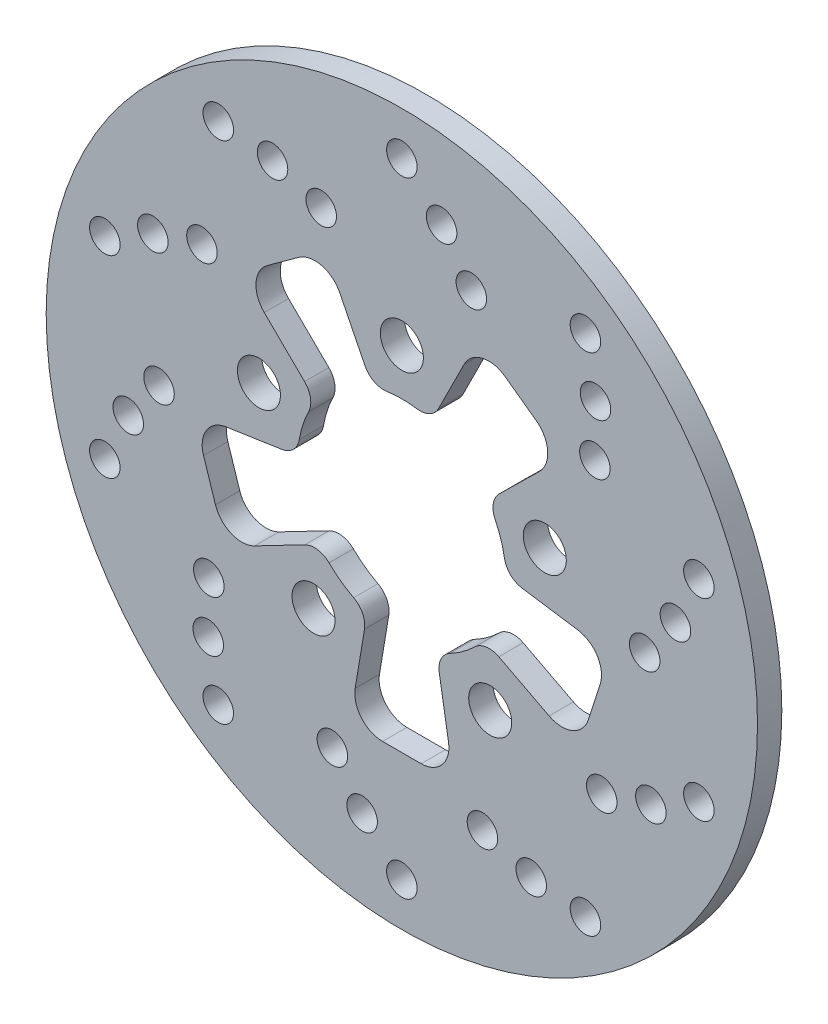
from build123d import *

# Parameters (mm, degrees)
SKETCH1_R                = 130.175
SKETCH1_R_2              = 7.874
EXTRUDE1_DEPTH           = 8.89
SKETCH3_R                = 38.1
EXTRUDE3_DEPTH           = 185.309775514
SKETCH4_R                = 5.588
EXTRUDE4_DEPTH           = 185.309775514
EXTRUDE9_DEPTH           = 185.309775514
FILLET1_R                = 7.62
FILLET2_R                = 10.16
CIRPATTERN1_COUNT        = 5
FILLET1_OF_CIRPATTERN1_R = 7.62
FILLET2_OF_CIRPATTERN1_R = 10.16


with BuildPart() as part:
    # Sketch1 → Extrude1 (new body)
    with BuildSketch(Plane.XY):
        Circle(SKETCH1_R)
        with Locations((0, 55)):
            Circle(SKETCH1_R_2, mode=Mode.SUBTRACT)
        with Locations((52.308108396, 16.995934691)):
            Circle(SKETCH1_R_2, mode=Mode.SUBTRACT)
        with Locations((32.328188876, -44.495934691)):
            Circle(SKETCH1_R_2, mode=Mode.SUBTRACT)
        with Locations((-32.328188876, -44.495934691)):
            Circle(SKETCH1_R_2, mode=Mode.SUBTRACT)
        with Locations((-52.308108396, 16.995934691)):
            Circle(SKETCH1_R_2, mode=Mode.SUBTRACT)
    extrude(amount=EXTRUDE1_DEPTH)

    # Sketch3 → Extrude3 (cut, through all)
    with BuildSketch(Plane(origin=(0, 0, 0), x_dir=(-1, 0, 0), z_dir=(0, 0, -1))):
        Circle(SKETCH3_R)
    extrude(amount=-EXTRUDE3_DEPTH, mode=Mode.SUBTRACT)

    # Sketch4 → Extrude4 (cut, through all)
    with BuildSketch(Plane.XY.offset(8.89)):
        with Locations((0, 114.3)):
            Circle(SKETCH4_R)
        with Locations((14.540907903, 100.554074991)):
            Circle(SKETCH4_R)
        with Locations((25.431391759, 85.18482443)):
            Circle(SKETCH4_R)
        with Locations((70.868043945, 72.803024301)):
            Circle(SKETCH4_R)
        with Locations((70.644811643, 53.967773605)):
            Circle(SKETCH4_R)
        with Locations((67.183854337, 92.470642457)):
            Circle(SKETCH4_R)
        with Locations((100.125995916, 17.243692812)):
            Circle(SKETCH4_R)
        with Locations((88.874314608, 2.13686756)):
            Circle(SKETCH4_R)
        with Locations((108.705759813, 35.320642457)):
            Circle(SKETCH4_R)
        with Locations((91.139220605, -44.90214324)):
            Circle(SKETCH4_R)
        with Locations((73.156850119, -50.510249263)):
            Circle(SKETCH4_R)
        with Locations((108.705759813, -35.320642457)):
            Circle(SKETCH4_R)
        with Locations((47.34036073, -89.896886742)):
            Circle(SKETCH4_R)
        with Locations((29.495955395, -83.864167648)):
            Circle(SKETCH4_R)
        with Locations((67.183854337, -92.470642457)):
            Circle(SKETCH4_R)
        with Locations((-14.540907903, -100.554074991)):
            Circle(SKETCH4_R)
        with Locations((-25.431391759, -85.18482443)):
            Circle(SKETCH4_R)
        with Locations((0, -114.3)):
            Circle(SKETCH4_R)
        with Locations((-70.868043945, -72.803024301)):
            Circle(SKETCH4_R)
        with Locations((-70.644811643, -53.967773605)):
            Circle(SKETCH4_R)
        with Locations((-67.183854337, -92.470642457)):
            Circle(SKETCH4_R)
        with Locations((-100.125995916, -17.243692812)):
            Circle(SKETCH4_R)
        with Locations((-88.874314608, -2.13686756)):
            Circle(SKETCH4_R)
        with Locations((-108.705759813, -35.320642457)):
            Circle(SKETCH4_R)
        with Locations((-91.139220605, 44.90214324)):
            Circle(SKETCH4_R)
        with Locations((-73.156850119, 50.510249263)):
            Circle(SKETCH4_R)
        with Locations((-108.705759813, 35.320642457)):
            Circle(SKETCH4_R)
        with Locations((-47.34036073, 89.896886742)):
            Circle(SKETCH4_R)
        with Locations((-29.495955395, 83.864167648)):
            Circle(SKETCH4_R)
        with Locations((-67.183854337, 92.470642457)):
            Circle(SKETCH4_R)
    extrude(amount=-EXTRUDE4_DEPTH, mode=Mode.SUBTRACT)

    # Sketch8 → Extrude9 (cut, through all)
    with BuildSketch(Plane.XY.offset(8.89)):
        Polygon((28.096692809, 71.081575805), (58.920240294, 48.686957693), (31.388364268, 21.595846559), (10.839332611, 36.525591967), align=None)
    extrude9 = extrude(amount=-EXTRUDE9_DEPTH, mode=Mode.SUBTRACT)

    # Fillet1
    fillet1_edges = [part.edges().sort_by_distance(p)[0] for p in [
        (31.388364268, 21.595846559, 4.445),
        (10.839332611, 36.525591967, 4.445),
    ]]
    fillet(fillet1_edges, radius=FILLET1_R)

    # Fillet2
    fillet2_edges = [part.edges().sort_by_distance(p)[0] for p in [
        (58.920240294, 48.686957693, 4.445),
        (28.096692809, 71.081575805, 4.445),
    ]]
    fillet(fillet2_edges, radius=FILLET2_R)

    # CirPattern1: Extrude9 ×5 about axis
    cirpattern1_axis = Axis((0, 0, 0), (0, 0, -1))
    for i in range(1, CIRPATTERN1_COUNT):
        add(extrude9.rotate(cirpattern1_axis, i * 360 / CIRPATTERN1_COUNT), mode=Mode.SUBTRACT)

    # Fillet1 of CirPattern1
    fillet1_of_cirpattern1_edges = [part.edges().sort_by_distance(p)[0] for p in [
        (30.238408579, -23.178624778, 4.445),
        (38.087440236, 0.978210736, 4.445),
        (-12.7, -35.921024484, 4.445),
        (12.7, -35.921024484, 4.445),
        (-38.087440236, 0.978210736, 4.445),
        (-30.238408579, -23.178624778, 4.445),
        (-10.839332611, 36.525591967, 4.445),
        (-31.388364268, 21.595846559, 4.445),
    ]]
    fillet(fillet1_of_cirpattern1_edges, radius=FILLET1_OF_CIRPATTERN1_R)

    # Fillet2 of CirPattern1
    fillet2_of_cirpattern1_edges = [part.edges().sort_by_distance(p)[0] for p in [
        (64.511403936, -40.991381142, 4.445),
        (76.284951421, -4.756127871, 4.445),
        (-19.05, -74.021024484, 4.445),
        (19.05, -74.021024484, 4.445),
        (-76.284951421, -4.756127871, 4.445),
        (-64.511403936, -40.991381142, 4.445),
        (-28.096692809, 71.081575805, 4.445),
        (-58.920240294, 48.686957693, 4.445),
    ]]
    fillet(fillet2_of_cirpattern1_edges, radius=FILLET2_OF_CIRPATTERN1_R)


solid = part.part
